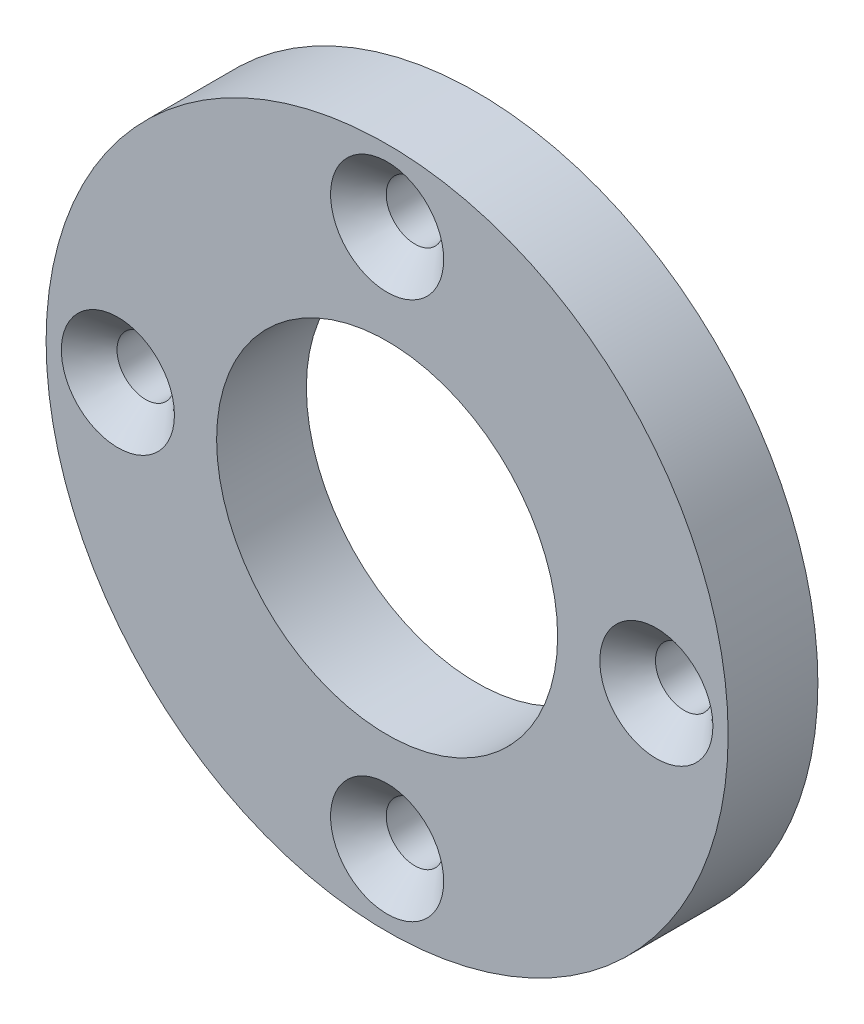
from build123d import *

# Parameters (mm, degrees)
SKETCH_1_R                   = 19
SKETCH_1_R_2                 = 9.5
EXTRUDE_1_DEPTH              = 5
HOLE_WIZARD_M3_1_D           = 3.2
HOLE_WIZARD_M3_1_CSINK_D     = 6.3
HOLE_WIZARD_M3_1_CSINK_ANGLE = 90


with BuildPart() as part:
    # ｽｹｯﾁ1 → ﾎﾞｽ - 押し出し1 (new body)
    with BuildSketch(Plane.XY):
        Circle(SKETCH_1_R)
        Circle(SKETCH_1_R_2, mode=Mode.SUBTRACT)
    extrude(amount=EXTRUDE_1_DEPTH)

    # M3 丸皿ねじ用皿穴1 (through all)
    with Locations(Plane(origin=(0, 15, 5), x_dir=(1, 0, 0), z_dir=(0, 0, 1))):
        with Locations((0, 0), (15, -15), (0, -30), (-15, -15)):
            CounterSinkHole(HOLE_WIZARD_M3_1_D / 2, HOLE_WIZARD_M3_1_CSINK_D / 2, counter_sink_angle=HOLE_WIZARD_M3_1_CSINK_ANGLE)


solid = part.part
